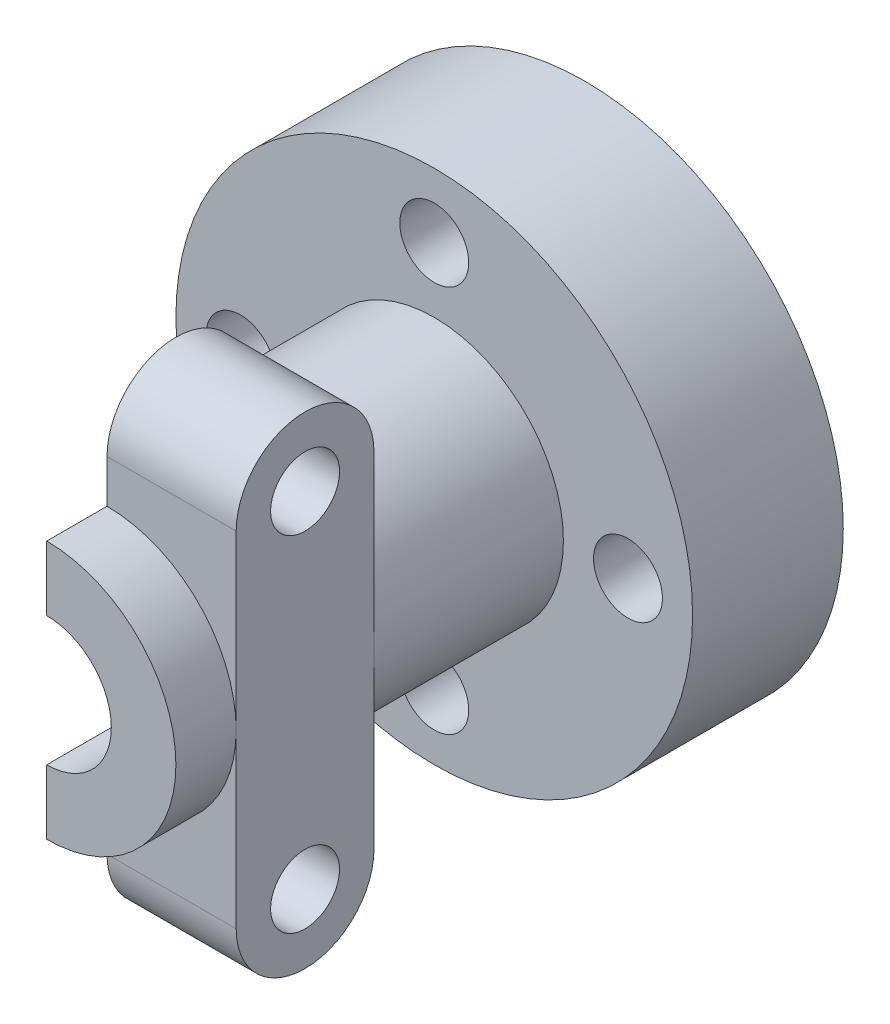
from build123d import *

# Parameters (mm, degrees)
SKETCH1_R               = 60
SKETCH1_R_2             = 30
BOSS_EXTRUDE1_DEPTH     = 35
SKETCH1_3_R             = 30
BOSS_EXTRUDE2_DEPTH     = 125
BOSS_EXTRUDE3_DEPTH     = 30
CUT_EXTRUDE2_DEPTH      = 152.079449297
CUT_EXTRUDE2_DEPTH_BACK = 152.079449297
SKETCH5_R               = 10
CUT_EXTRUDE3_DEPTH      = 152.079449297
CUT_EXTRUDE3_DEPTH_BACK = 60
CUT_EXTRUDE4_DEPTH      = 60
SKETCH9_R               = 8
CUT_EXTRUDE5_DEPTH      = 166.302752548
SKETCH10_R              = 8
CUT_EXTRUDE6_DEPTH      = 124.693168769
SKETCH11_R              = 55
CUT_EXTRUDE7_DEPTH      = 15


with BuildPart() as part:
    # Sketch1 → Boss-Extrude1 (new body)
    # profile 1 of 2: a face of its own
    with BuildSketch(Plane(origin=(0, 0, 0), x_dir=(0, 1, 0), z_dir=(0, 0, 1))):
        with Locations(Location((0, 0, 0), (0, 0, 270))):
            Circle(SKETCH1_R)
        Circle(SKETCH1_R_2, mode=Mode.SUBTRACT)
    # profile 2 of 2: a face of its own
    with BuildSketch(Plane(origin=(0, 0, 0), x_dir=(0, 1, 0), z_dir=(0, 0, 1))):
        Circle(SKETCH1_R_2)
    extrude(amount=BOSS_EXTRUDE1_DEPTH)

    # Sketch1<3> → Boss-Extrude2 (add)
    with BuildSketch(Plane(origin=(0, 0, 0), x_dir=(0, 1, 0), z_dir=(0, 0, 1))):
        with Locations(Location((0, 0, 0), (0, 0, 270))):
            Circle(SKETCH1_3_R)
    extrude(amount=BOSS_EXTRUDE2_DEPTH)

    # Sketch4 → Boss-Extrude3 (add)
    with BuildSketch(Plane.YZ):
        with BuildLine():
            Line((40, 79), (-40, 79))
            ThreePointArc((-40, 79), (-56, 95), (-40, 111))
            Line((-40, 111), (40, 111))
            ThreePointArc((40, 111), (56, 95), (40, 79))
        make_face()
    extrude(amount=BOSS_EXTRUDE3_DEPTH)

    # Sketch5 → Cut-Extrude2 (cut, two sides: drawn at the far end of the back side and taken through both)
    with BuildSketch(Plane.XY.offset(125).offset(-CUT_EXTRUDE2_DEPTH_BACK)):
        Circle(SKETCH5_R)
    extrude(amount=CUT_EXTRUDE2_DEPTH + CUT_EXTRUDE2_DEPTH_BACK, mode=Mode.SUBTRACT)

    # Sketch7 → Cut-Extrude3 (cut, two sides: drawn at the far end of the back side and taken through both)
    with BuildSketch(Plane.XY.offset(125).offset(-CUT_EXTRUDE3_DEPTH_BACK)):
        with BuildLine():
            Line((0, 30), (0, -30))
            ThreePointArc((0, -30), (-30, 0), (0, 30))
        make_face()
    extrude(amount=CUT_EXTRUDE3_DEPTH + CUT_EXTRUDE3_DEPTH_BACK, mode=Mode.SUBTRACT)

    # Sketch8 → Cut-Extrude4 (cut)
    with BuildSketch(Plane.XY.offset(125)):
        with BuildLine():
            Line((0, 15), (0, 10))
            ThreePointArc((0, 10), (10, 0), (0, -10))
            Line((0, -10), (0, -15))
            ThreePointArc((0, -15), (15, 0), (0, 15))
        make_face()
    extrude(amount=-CUT_EXTRUDE4_DEPTH, mode=Mode.SUBTRACT)

    # Sketch9 → Cut-Extrude5 (cut, through all)
    with BuildSketch(Plane.YZ.offset(30)):
        with Locations(Location((-40, 95, 0), (0, 0, 270))):
            Circle(SKETCH9_R)
        with Locations(Location((40, 95, 0), (0, 0, 270))):
            Circle(SKETCH9_R)
    extrude(amount=-CUT_EXTRUDE5_DEPTH, mode=Mode.SUBTRACT)

    # Sketch10 → Cut-Extrude6 (cut, through all)
    with BuildSketch(Plane.XY.offset(35)):
        with Locations((-45, 0)):
            Circle(SKETCH10_R)
        with Locations((0, 45)):
            Circle(SKETCH10_R)
        with Locations((45, 0)):
            Circle(SKETCH10_R)
        with Locations((0, -45)):
            Circle(SKETCH10_R)
    extrude(amount=-CUT_EXTRUDE6_DEPTH, mode=Mode.SUBTRACT)

    # Sketch11 → Cut-Extrude7 (cut)
    with BuildSketch(Plane(origin=(0, 0, 0), x_dir=(1, 0, 0), z_dir=(0, 0, -1))):
        with Locations(Location((0, 0, 0), (0, 0, 180))):
            Circle(SKETCH11_R)
    extrude(amount=-CUT_EXTRUDE7_DEPTH, mode=Mode.SUBTRACT)


solid = part.part
